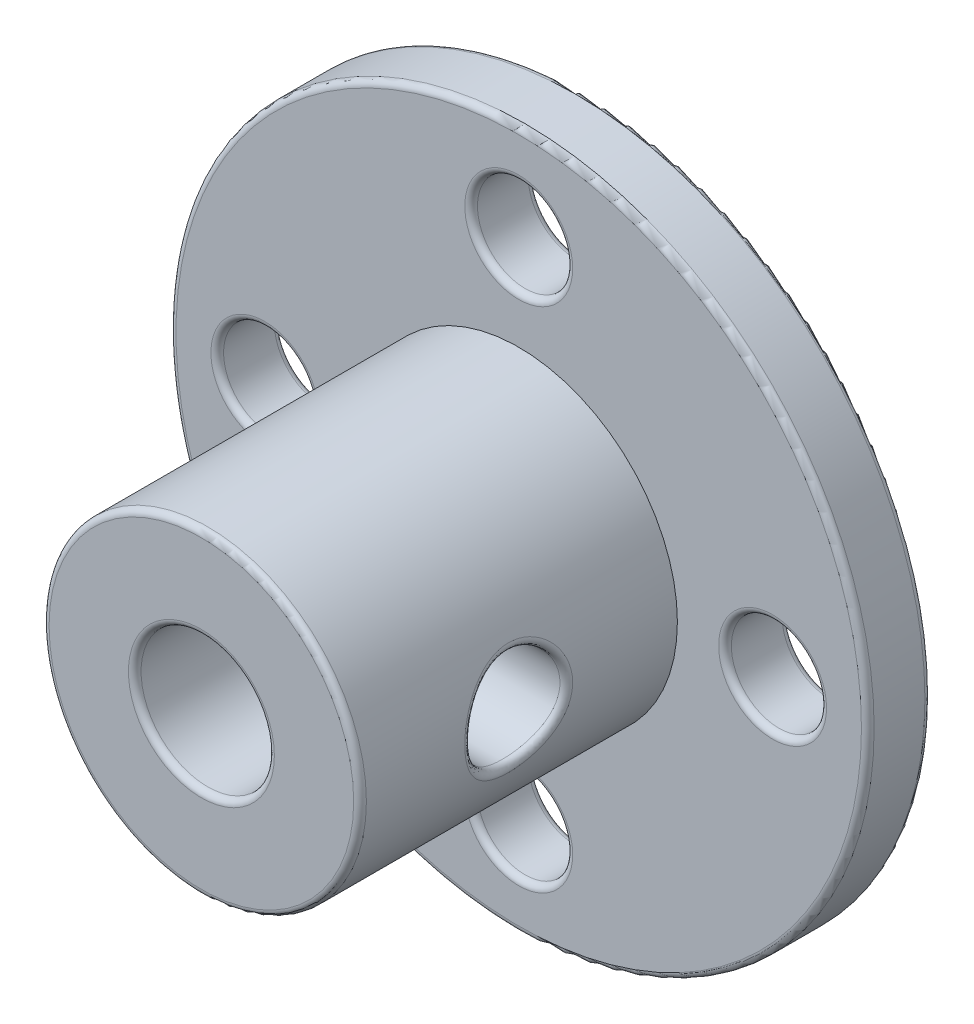
from build123d import *

# Parameters (mm, degrees)
SKETCH1_R               = 11
BOSS_EXTRUDE1_DEPTH     = 2
BOSS_EXTRUDE2_START     = 2
SKETCH2_R               = 5
BOSS_EXTRUDE2_DEPTH     = 10
SKETCH3_R               = 2.1
CUT_EXTRUDE1_DEPTH      = 20.646882704
SKETCH5_R               = 1.5
CUT_EXTRUDE2_DEPTH      = 20.646882704
CUT_EXTRUDE3_DEPTH      = 20.646882704
CUT_EXTRUDE3_DEPTH_BACK = 20.646882704
SKETCH6_R               = 1.5
FILLET1_R               = 0.2


with BuildPart() as part:
    # Sketch1 → Boss-Extrude1 (new body)
    with BuildSketch(Plane.XY):
        Circle(SKETCH1_R)
    extrude(amount=BOSS_EXTRUDE1_DEPTH)

    # Sketch2 → Boss-Extrude2 (add)
    with BuildSketch(Plane.XY.offset(BOSS_EXTRUDE2_START)):
        Circle(SKETCH2_R)
    extrude(amount=BOSS_EXTRUDE2_DEPTH)

    # Sketch3 → Cut-Extrude1 (cut, through all)
    with BuildSketch(Plane.XY):
        Circle(SKETCH3_R)
    extrude(amount=CUT_EXTRUDE1_DEPTH, mode=Mode.SUBTRACT)

    # Sketch5 → Cut-Extrude2 (cut, through all)
    with BuildSketch(Plane.XY):
        with Locations((0, 8)):
            Circle(SKETCH5_R)
        with Locations((8, 0)):
            Circle(SKETCH5_R)
        with Locations((0, -8)):
            Circle(SKETCH5_R)
        with Locations((-8, 0)):
            Circle(SKETCH5_R)
    extrude(amount=CUT_EXTRUDE2_DEPTH, mode=Mode.SUBTRACT)

    # Sketch6 → Cut-Extrude3 (cut, two sides: drawn at the far end of the back side and taken through both)
    with BuildSketch(Plane(origin=(0, 0, 0), x_dir=(0, 0, -1), z_dir=(1, 0, 0)).offset(-CUT_EXTRUDE3_DEPTH_BACK)):
        with Locations((-7, 0)):
            Circle(SKETCH6_R)
    extrude(amount=CUT_EXTRUDE3_DEPTH + CUT_EXTRUDE3_DEPTH_BACK, mode=Mode.SUBTRACT)

    # Fillet1
    fillet1_edges = [part.edges().sort_by_distance(p)[0] for p in [
        (-2.1, 0, 0),
        (-2.1, 0, 12),
        (-11, 0, 0),
        (-1.5, 8, 2),
        (-1.5, 8, 0),
        (6.5, 0, 2),
        (6.5, 0, 0),
        (-1.5, -8, 2),
        (-1.5, -8, 0),
        (-9.5, 0, 2),
        (-9.5, 0, 0),
        (-5, 0, 8.5),
        (4.769696007, 1.5, 7),
        (-11, 0, 2),
        (-5, 0, 12),
    ]]
    fillet(fillet1_edges, radius=FILLET1_R)


solid = part.part
